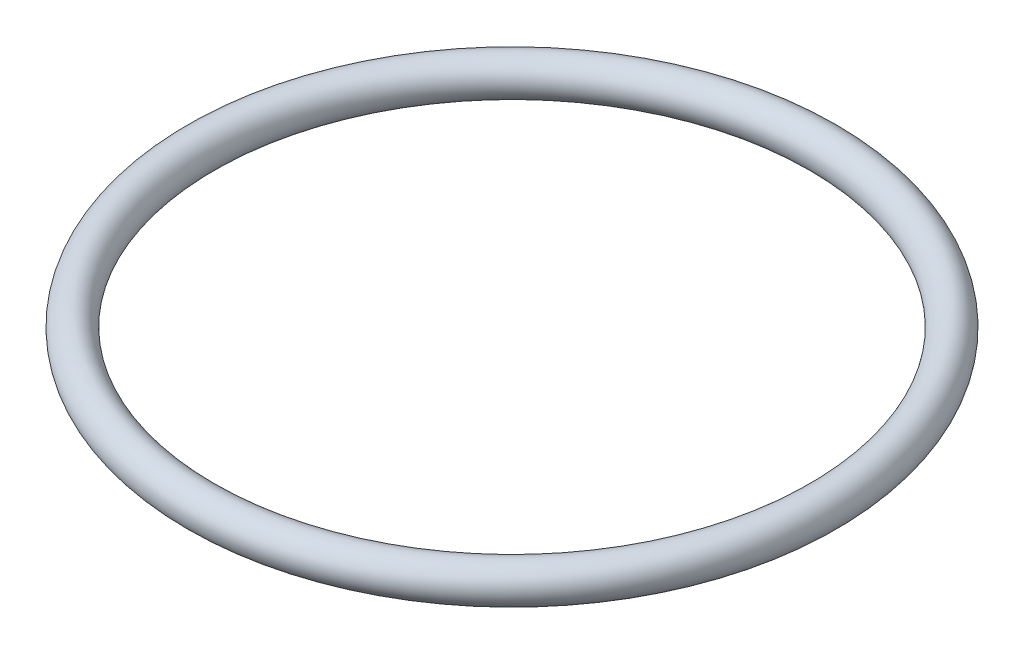
from build123d import *

# Parameters (mm, degrees)
SZKIC1_R = 1.5


with BuildPart() as part:
    # Szkic1 → Obrót1 (revolve)
    with BuildSketch(Plane.XY, mode=Mode.PRIVATE) as obr_t1_sk:
        with Locations((-25, -1.38996772)):
            Circle(SZKIC1_R)
    revolve(obr_t1_sk.sketch.rotate(Axis((0, 5.124503541, 0), (0, -1, 0)), 270), axis=Axis((0, 5.124503541, 0), (0, -1, 0)))


solid = part.part
